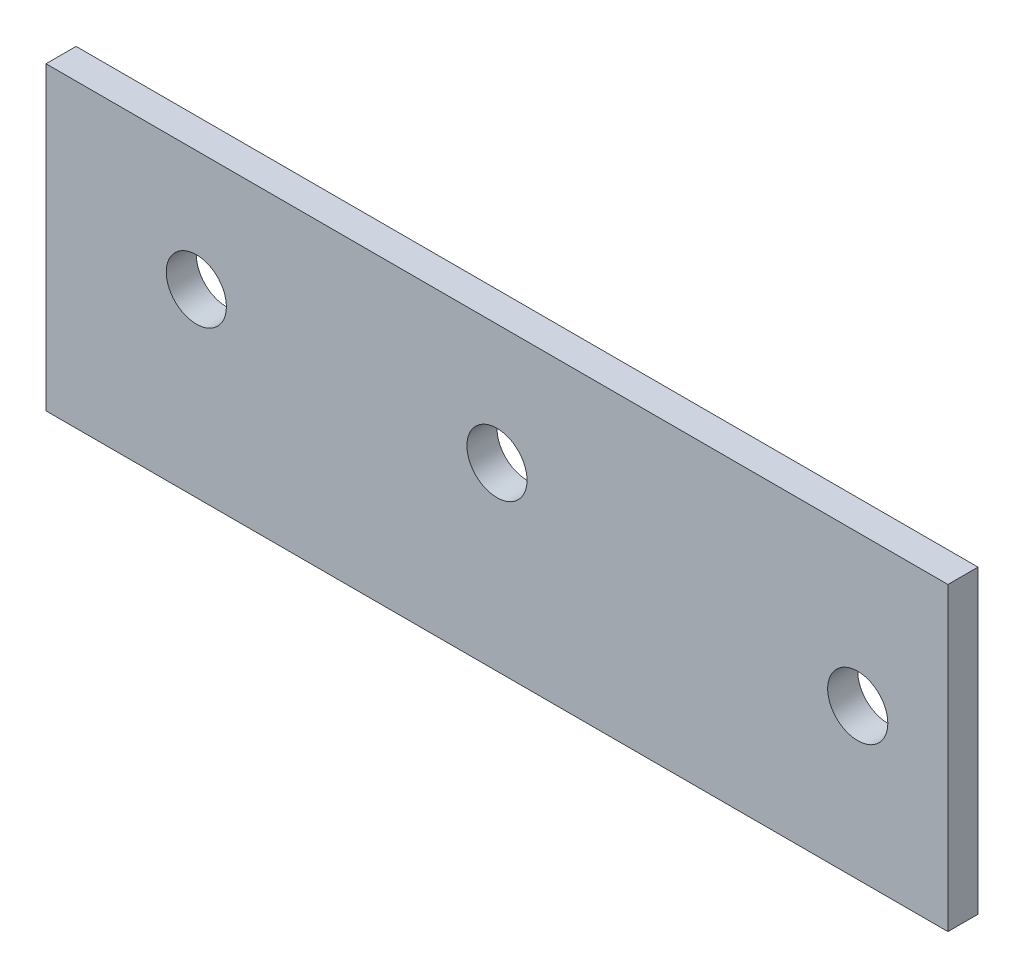
from build123d import *

# Parameters (mm, degrees)
ESQUISSE1_W      = 45
ESQUISSE1_H      = 15
ESQUISSE1_R      = 1.5
EXTRUSION1_DEPTH = 1.5


with BuildPart() as part:
    # Esquisse1 → Extrusion1 (new body)
    with BuildSketch(Plane.XY):
        with Locations((521.091325712, 1880.589488961)):
            Rectangle(ESQUISSE1_W, ESQUISSE1_H)
        with Locations((506.091325712, 1882.089488961)):
            Circle(ESQUISSE1_R, mode=Mode.SUBTRACT)
        with Locations((521.091325712, 1882.089488961)):
            Circle(ESQUISSE1_R, mode=Mode.SUBTRACT)
        with Locations((539.091325712, 1880.589488961)):
            Circle(ESQUISSE1_R, mode=Mode.SUBTRACT)
    extrude(amount=EXTRUSION1_DEPTH)


solid = part.part
